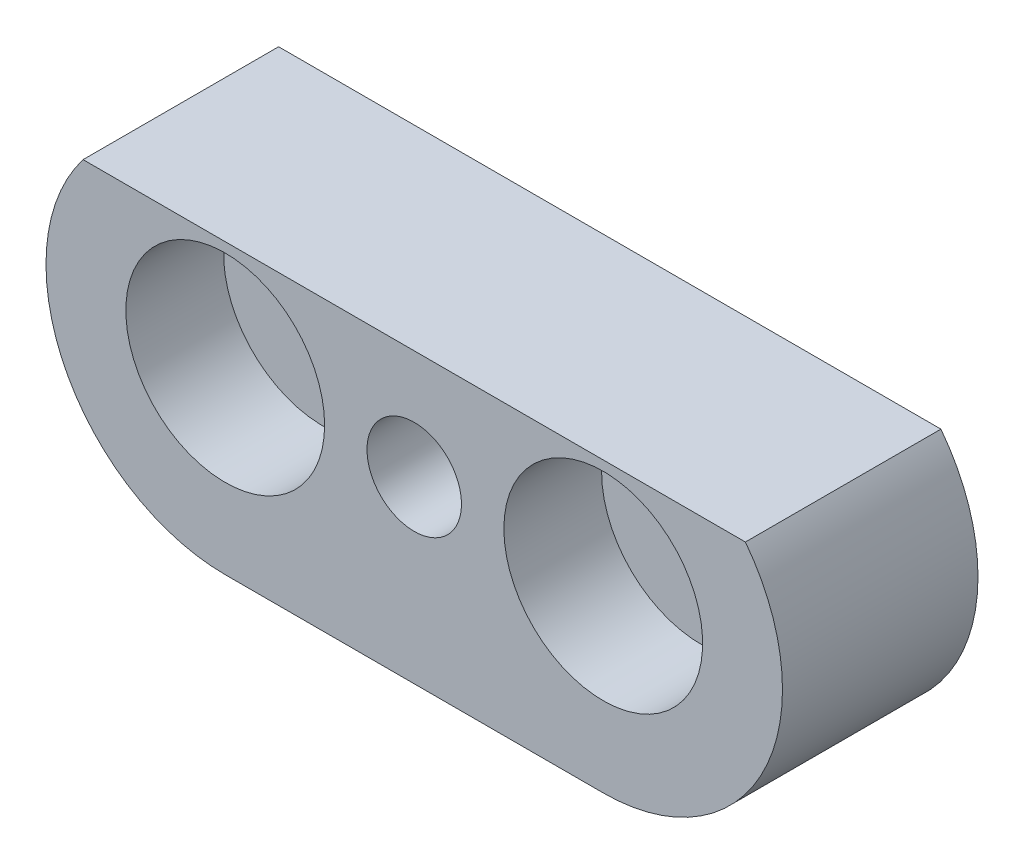
from build123d import *

# Parameters (mm, degrees)
SKETCH1_R           = 3.5
SKETCH1_R_2         = 3.1
EXTRUDE_THIN1_DEPTH = 2
BOSS_EXTRUDE1_DEPTH = 4
SKETCH3_R           = 3.05
CUT_EXTRUDE1_DEPTH  = 3
CUT_EXTRUDE2_REACH  = 15.016
SKETCH4_R           = 1.45
BOSS_EXTRUDE2_START = 2
SKETCH5_R           = 1.45
BOSS_EXTRUDE2_DEPTH = 2
FILLET1_R           = 1
EXTRUDE_THIN2_START = -6
EXTRUDE_THIN2_DEPTH = 6
CUT_EXTRUDE3_REACH  = 17.557


with BuildPart() as part:
    # Sketch1 → Extrude-Thin1 (new body)
    with BuildSketch(Plane.XY):
        with Locations((-5.8, 3.35)):
            Circle(SKETCH1_R)
        with Locations((-5.8, 3.35)):
            Circle(SKETCH1_R_2, mode=Mode.SUBTRACT)
    extrude(amount=EXTRUDE_THIN1_DEPTH)


with BuildPart() as body_2:
    # Mirror3: mirrored copy
    add(part.part.mirror(Plane(origin=(0, 0, 0), x_dir=(0, 0, 1), z_dir=(1, 0, 0))))


with BuildPart() as part_1:
    add(part.part)

    add(body_2.part)  # Boss-Extrude1 merges body 2
    # Sketch2 → Boss-Extrude1 (add)
    with BuildSketch(Plane.XY.offset(2)):
        with BuildLine():
            Line((-5.8, 6.85), (5.8, 6.85))
            ThreePointArc((5.8, 6.85), (9.3, 3.35), (5.8, -0.15))
            Line((5.8, -0.15), (-5.8, -0.15))
            ThreePointArc((-5.8, -0.15), (-9.3, 3.35), (-5.8, 6.85))
        make_face()
    extrude(amount=BOSS_EXTRUDE1_DEPTH)

    # Sketch3 → Cut-Extrude1 (cut)
    with BuildSketch(Plane.XY.offset(6)):
        with Locations((-5.8, 3.35)):
            Circle(SKETCH3_R)
    cut_extrude1 = extrude(amount=-CUT_EXTRUDE1_DEPTH, mode=Mode.SUBTRACT)

    # Mirror4: Cut-Extrude1 across plane
    add(cut_extrude1.mirror(Plane(origin=(0, 0, 0), x_dir=(0, 0, 1), z_dir=(1, 0, 0))), mode=Mode.SUBTRACT)

    # Sketch4 → Cut-Extrude2 (cut, up to next)
    with BuildSketch(Plane.XY.offset(6), mode=Mode.PRIVATE) as cut_extrude2_sk1:
        with Locations((0, 3.35)):
            Circle(SKETCH4_R)
    cut_extrude2_tool1 = extrude(cut_extrude2_sk1.sketch, amount=-CUT_EXTRUDE2_REACH, mode=Mode.PRIVATE) & part_1.part
    add(cut_extrude2_tool1.solids().sort_by_distance((0, 3.35, 6))[0], mode=Mode.SUBTRACT)

    # Sketch5 → Boss-Extrude2 (add)
    with BuildSketch(Plane(origin=(0, 0, 2), x_dir=(-1, 0, 0), z_dir=(0, 0, -1)).offset(BOSS_EXTRUDE2_START)):
        with BuildLine():
            Line((-5.8, -0.15), (5.8, -0.15))
            ThreePointArc((5.8, -0.15), (2.3, 3.35), (5.8, 6.85))
            Line((5.8, 6.85), (-5.8, 6.85))
            ThreePointArc((-5.8, 6.85), (-2.3, 3.35), (-5.8, -0.15))
        make_face()
        with Locations(Location((0, 3.35, 0), (0, 0, 180))):
            Circle(SKETCH5_R, mode=Mode.SUBTRACT)
    extrude(amount=-BOSS_EXTRUDE2_DEPTH)

    # Fillet1
    fillet1_edges = [part_1.edges().sort_by_distance(p)[0] for p in [
        (-8.9, 3.35, 2),
        (8.9, 3.35, 2),
    ]]
    fillet(fillet1_edges, radius=FILLET1_R)

    # Sketch6 → Extrude-Thin2 (add)
    with BuildSketch(Plane.XY.offset(6).offset(EXTRUDE_THIN2_START)):
        with BuildLine():
            Line((5.8, 8.85), (-5.8, 8.85))
            ThreePointArc((-5.8, 8.85), (-11.3, 3.35), (-5.8, -2.15))
            Line((-5.8, -2.15), (5.8, -2.15))
            ThreePointArc((5.8, -2.15), (11.3, 3.35), (5.8, 8.85))
        make_face()
        with BuildLine():
            Line((5.8, 6.85), (-5.8, 6.85))
            ThreePointArc((-5.8, 6.85), (-9.3, 3.35), (-5.8, -0.15))
            Line((-5.8, -0.15), (5.8, -0.15))
            ThreePointArc((5.8, -0.15), (9.3, 3.35), (5.8, 6.85))
        make_face(mode=Mode.SUBTRACT)
    extrude(amount=EXTRUDE_THIN2_DEPTH)

    # Sketch7 → Cut-Extrude3 (cut, up to next)
    with BuildSketch(Plane.XY.offset(6), mode=Mode.PRIVATE) as cut_extrude3_sk1:
        with BuildLine():
            Line((-10.162052269, 6.7), (10.162052269, 6.7))
            ThreePointArc((10.162052269, 6.7), (8.231563283, 8.28330518), (5.8, 8.85))
            Line((5.8, 8.85), (-5.8, 8.85))
            ThreePointArc((-5.8, 8.85), (-8.231563283, 8.28330518), (-10.162052269, 6.7))
        make_face()
    cut_extrude3_tool1 = extrude(cut_extrude3_sk1.sketch, amount=-CUT_EXTRUDE3_REACH, mode=Mode.PRIVATE) & part_1.part
    add(cut_extrude3_tool1.solids().sort_by_distance((0, 7.706585, 6))[0], mode=Mode.SUBTRACT)


solid = part_1.part
